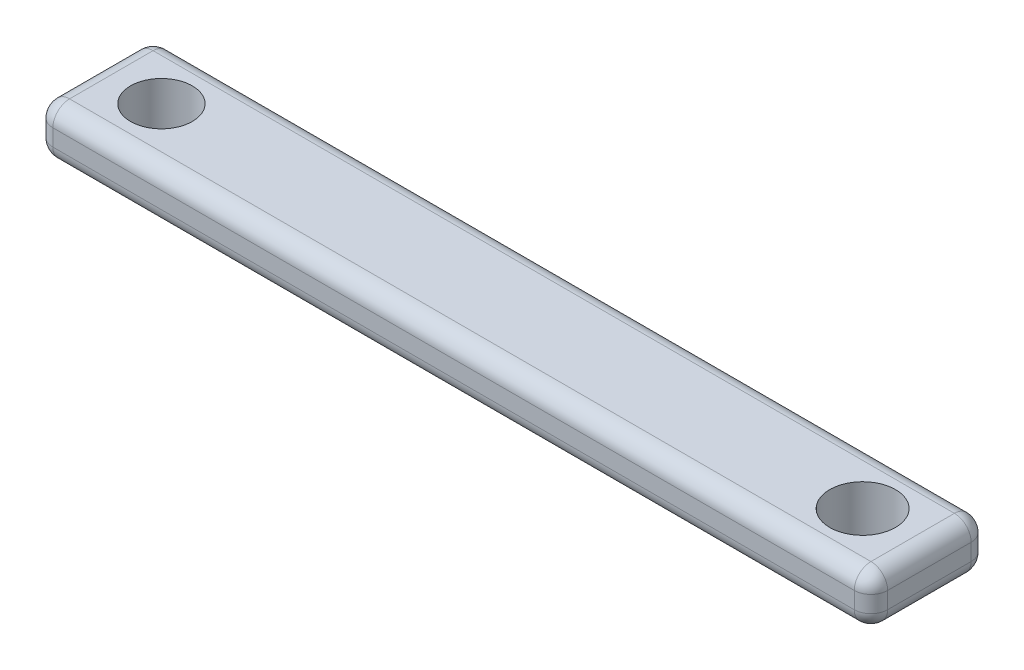
from build123d import *

# Parameters (mm, degrees)
SKETCH1_W           = 63.5
SKETCH1_H           = 8.89
BOSS_EXTRUDE1_DEPTH = 3.81
FILLET1_R           = 1.27
SKETCH2_R           = 2.35
SKETCH2_R_2         = 2.5
CUT_EXTRUDE1_DEPTH  = 41.820799329


with BuildPart() as part:
    # Sketch1 → Boss-Extrude1 (new body)
    with BuildSketch(Plane(origin=(0, 0, 0), x_dir=(1, 0, 0), z_dir=(0, 1, 0))):
        with Locations((-4.799174917, 13.330808581)):
            Rectangle(SKETCH1_W, SKETCH1_H)
    extrude(amount=BOSS_EXTRUDE1_DEPTH)

    # Fillet1
    fillet1_edges = [part.edges().sort_by_distance(p)[0] for p in [
        (26.950825083, 3.81, -13.330808581),
        (-4.799174917, 3.81, -17.775808581),
        (-36.549174917, 3.81, -13.330808581),
        (-4.799174917, 0, -17.775808581),
        (26.950825083, 0, -13.330808581),
        (-4.799174917, 0, -8.885808581),
        (-36.549174917, 0, -13.330808581),
        (-36.549174917, 1.905, -17.775808581),
        (26.950825083, 1.905, -17.775808581),
        (26.950825083, 1.905, -8.885808581),
        (-36.549174917, 1.905, -8.885808581),
        (-4.799174917, 3.81, -8.885808581),
    ]]
    fillet(fillet1_edges, radius=FILLET1_R)

    # Sketch2 → Cut-Extrude1 (cut, through all)
    with BuildSketch(Plane(origin=(0, 3.81, 0), x_dir=(1, 0, 0), z_dir=(0, 1, 0))):
        with Locations(Location((-31.469174917, 13.330808581, 0), (0, 0, 270))):
            Circle(SKETCH2_R)
        with Locations(Location((21.870825083, 13.330808581, 0), (0, 0, 270))):
            Circle(SKETCH2_R_2)
    extrude(amount=-CUT_EXTRUDE1_DEPTH, mode=Mode.SUBTRACT)


solid = part.part
